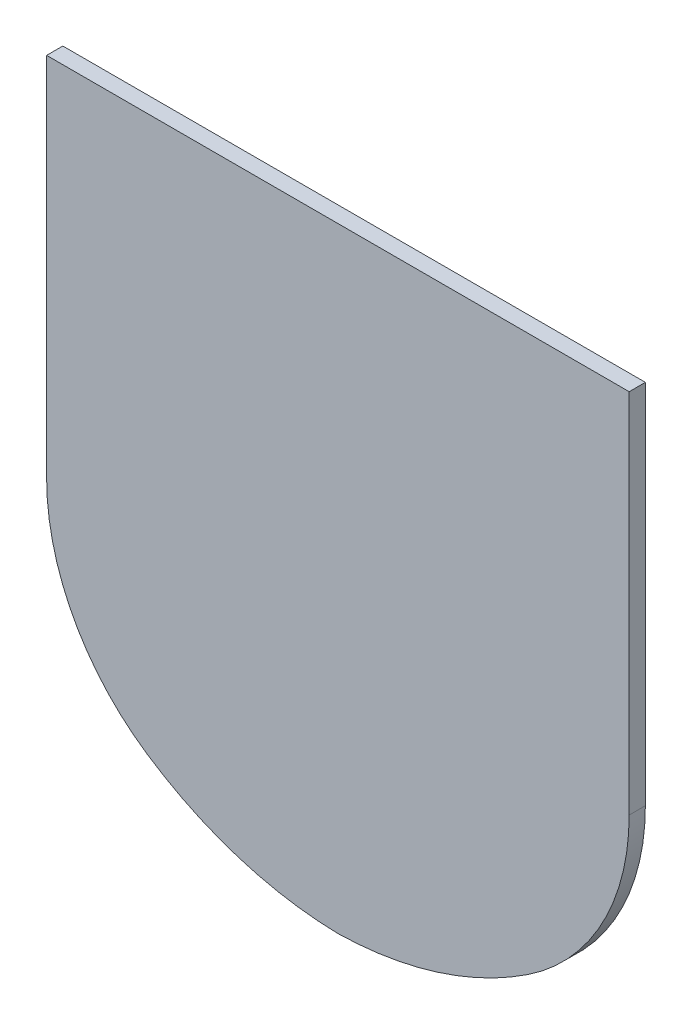
from build123d import *

# Parameters (mm, degrees)
SKETCH_1_W          = 9
SKETCH_1_H          = 19
EXTRUDE_2_DEPTH     = 0.5
CUT_EXTRUDE_1_DEPTH = 53.98770037
FILLET_1_R          = 7


with BuildPart() as part:
    # 草圖1 → 填料-伸長2 (new body)
    with BuildSketch(Plane.XY):
        with Locations((4.5, 42.715384615)):
            Rectangle(SKETCH_1_W, SKETCH_1_H)
        with Locations((-4.5, 42.715384615)):
            Rectangle(SKETCH_1_W, SKETCH_1_H)
    extrude(amount=EXTRUDE_2_DEPTH)

    # 草圖3 → 除料-伸長1 (cut, through all)
    with BuildSketch(Plane.XY.offset(0.5)):
        with BuildLine():
            Line((0, 33.215384615), (9, 33.215384615))
            Line((9, 33.215384615), (9, 38.215384615))
            ThreePointArc((9, 38.215384615), (5.121083379, 34.597434532), (0, 33.215384615))
        make_face()
        with BuildLine():
            Line((-9, 33.215384615), (0, 33.215384615))
            ThreePointArc((0, 33.215384615), (-5.121083379, 34.597434532), (-9, 38.215384615))
            Line((-9, 38.215384615), (-9, 33.215384615))
        make_face()
    extrude(amount=-CUT_EXTRUDE_1_DEPTH, mode=Mode.SUBTRACT)

    # 圓角1
    fillet_1_edges = [part.edges().sort_by_distance(p)[0] for p in [
        (9, 38.215384615, 0.25),
        (-9, 38.215384615, 0.25),
    ]]
    fillet(fillet_1_edges, radius=FILLET_1_R)


solid = part.part
